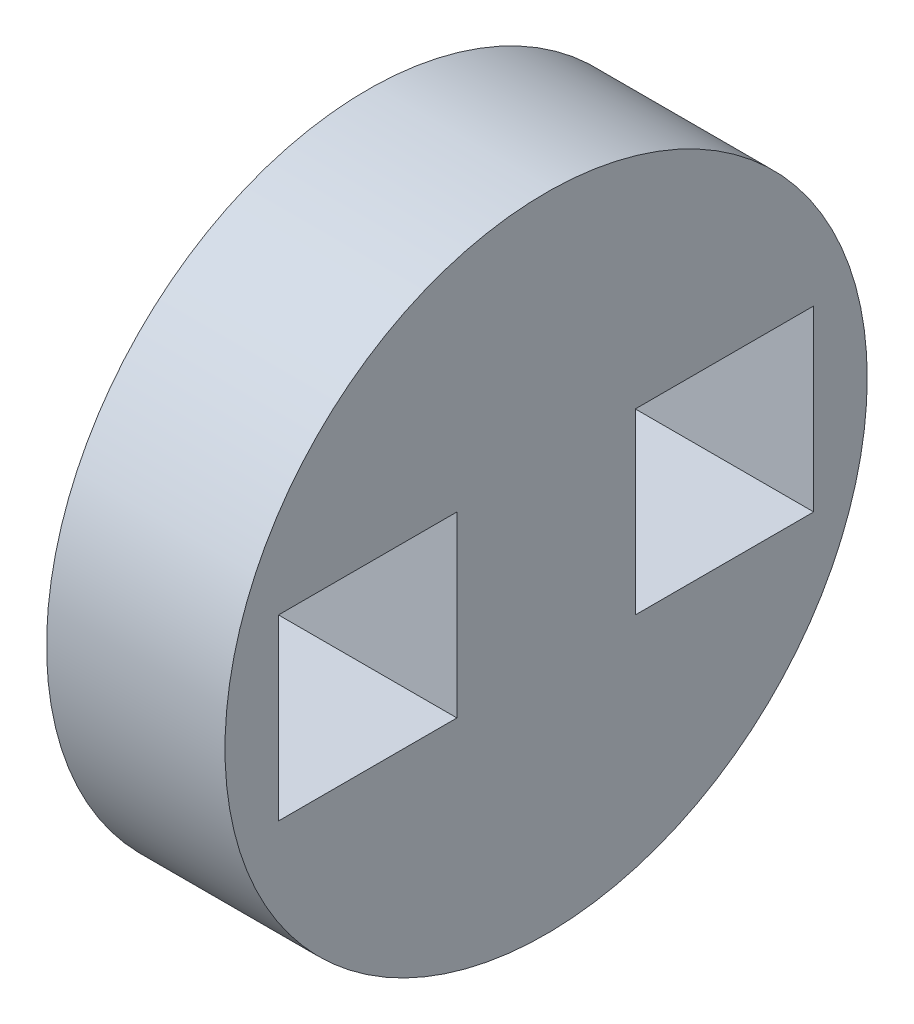
from build123d import *

# Parameters (mm, degrees)
SKETCH1_R           = 11.43
SKETCH1_W           = 6.35
SKETCH1_H           = 6.35
BOSS_EXTRUDE1_DEPTH = 6.35


with BuildPart() as part:
    # Sketch1 → Boss-Extrude1 (new body)
    with BuildSketch(Plane(origin=(0, 0, 0), x_dir=(0, 0, -1), z_dir=(1, 0, 0))):
        Circle(SKETCH1_R)
        with Locations((-6.35, 0)):
            Rectangle(SKETCH1_W, SKETCH1_H, mode=Mode.SUBTRACT)
        with Locations((6.35, 0)):
            Rectangle(SKETCH1_W, SKETCH1_H, mode=Mode.SUBTRACT)
    extrude(amount=BOSS_EXTRUDE1_DEPTH)


solid = part.part
